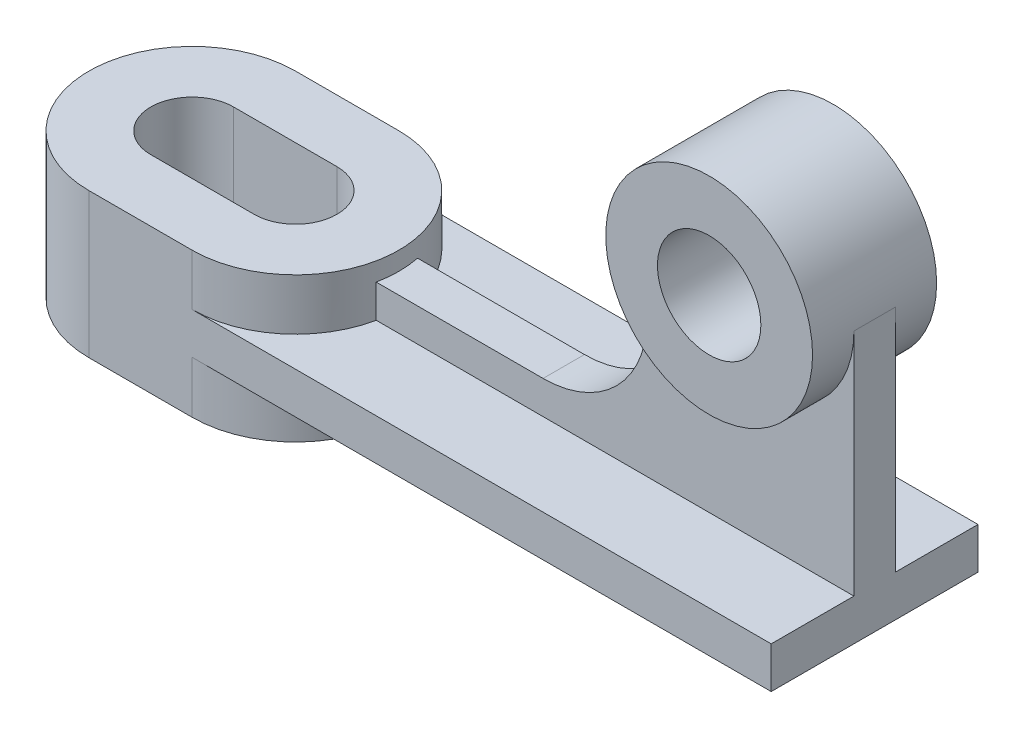
from build123d import *

# Parameters (mm, degrees)
BOSS_EXTRUDE1_DEPTH      = 35
BOSS_EXTRUDE2_REACH      = 211.564
BOSS_EXTRUDE2_END_RADIUS = 25
BOSS_EXTRUDE2_START      = 152.5
SKETCH2_W                = 50
SKETCH2_H                = 10
SKETCH3_R                = 25
SKETCH3_R_2              = 12.5
BOSS_EXTRUDE3_DEPTH      = 15
BOSS_EXTRUDE5_DEPTH      = 5
SKETCH5_W                = 10
SKETCH5_H                = 8
BOSS_EXTRUDE6_DEPTH      = 0.505103


with BuildPart() as part:
    # Sketch1 → Boss-Extrude1 (new body)
    with BuildSketch(Plane(origin=(0, 0, 0), x_dir=(1, 0, 0), z_dir=(0, 1, 0))):
        with BuildLine():
            Line((-12.5, 25), (12.5, 25))
            ThreePointArc((12.5, 25), (37.5, 0), (12.5, -25))
            Line((12.5, -25), (-12.5, -25))
            ThreePointArc((-12.5, -25), (-37.5, 0), (-12.5, 25))
        make_face()
        with BuildLine():
            Line((-12.5, 10), (12.5, 10))
            ThreePointArc((12.5, 10), (22.5, 0), (12.5, -10))
            Line((12.5, -10), (-12.5, -10))
            ThreePointArc((-12.5, -10), (-22.5, 0), (-12.5, 10))
        make_face(mode=Mode.SUBTRACT)
    extrude(amount=BOSS_EXTRUDE1_DEPTH)

    # Boss-Extrude2: up to this cylinder (the profile starts outside it)
    boss_extrude2_end = Plane(origin=(12.5, 17.570467, 0), z_dir=(0, -1, 0)) * Cylinder(BOSS_EXTRUDE2_END_RADIUS, 474.128, mode=Mode.PRIVATE)
    # Sketch2 → Boss-Extrude2 (add, up to the surface)
    with BuildSketch(Plane(origin=(0, 0, 0), x_dir=(0, 0, -1), z_dir=(1, 0, 0)).offset(BOSS_EXTRUDE2_START), mode=Mode.PRIVATE) as boss_extrude2_sk1:
        with Locations((0, 17.570467399)):
            Rectangle(SKETCH2_W, SKETCH2_H)
    boss_extrude2_tool1 = extrude(boss_extrude2_sk1.sketch, amount=-BOSS_EXTRUDE2_REACH, mode=Mode.PRIVATE) - boss_extrude2_end
    add(boss_extrude2_tool1.solids().sort_by_distance((152.5, 17.570467, 0))[0])



with BuildPart() as body_2:
    # Sketch3 → Boss-Extrude3 (new, symmetric)
    with BuildSketch(Plane.XY):
        with Locations((127.5, 78.070467399)):
            Circle(SKETCH3_R)
        with Locations((127.5, 78.070467399)):
            Circle(SKETCH3_R_2, mode=Mode.SUBTRACT)
    extrude(amount=BOSS_EXTRUDE3_DEPTH, both=True)


with BuildPart() as body_3:
    # Sketch4 → Boss-Extrude5 (new, symmetric)
    with BuildSketch(Plane.XY):
        with BuildLine():
            Line((152.5, 78.070467399), (152.5, 22.570467399))
            Line((152.5, 22.570467399), (37.5, 22.570467399))
            Line((37.5, 22.570467399), (37.5, 30.570467399))
            Line((37.5, 30.570467399), (77.34821208, 30.570467399))
            ThreePointArc((77.34821208, 30.570467399), (95.133211877, 37.937255521), (102.5, 55.722255318))
            Line((102.5, 55.722255318), (102.5, 78.070467399))
            ThreePointArc((102.5, 78.070467399), (127.5, 53.070467399), (152.5, 78.070467399))
        make_face()
    extrude(amount=BOSS_EXTRUDE5_DEPTH, both=True)


with BuildPart() as part_1:
    add(part.part)

    add(body_3.part)  # Boss-Extrude6 merges body 3
    # Sketch5 → Boss-Extrude6 (add)
    with BuildSketch(Plane.ZY.offset(-37.5)):
        with Locations((0, 26.570467399)):
            Rectangle(SKETCH5_W, SKETCH5_H)
    extrude(amount=BOSS_EXTRUDE6_DEPTH)


solid = Compound([body_2.part, part_1.part])
